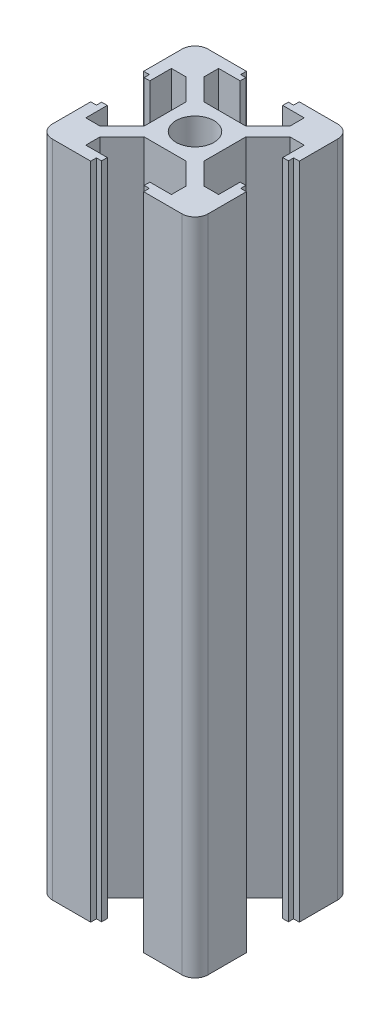
from build123d import *

# Parameters (mm, degrees)
SKETCH13_R                          = 3.65
BOSCHREXROTH_BOSCH_30X30_V2_1_DEPTH = 127


with BuildPart() as part:
    # Sketch13 → Boschrexroth BOSCH_30X30_V2(1) (new body)
    with BuildSketch(Plane.XZ.offset(-63.5)):
        with BuildLine():
            Line((0, 5.8), (-4.03, 5.8))
            Line((-4.03, 5.8), (-8.25, 10.02))
            Line((-8.25, 10.02), (-8.25, 12.8))
            Line((-8.25, 12.8), (-4.1, 12.8))
            Line((-4.1, 12.8), (-4.1, 13.9))
            Line((-4.1, 13.9), (-5.1, 13.9))
            Line((-5.1, 13.9), (-5.1, 15))
            Line((-5.1, 15), (-12.5, 15))
            ThreePointArc((-12.5, 15), (-14.267766953, 14.267766953), (-15, 12.5))
            Line((-15, 12.5), (-15, 5.1))
            Line((-15, 5.1), (-13.9, 5.1))
            Line((-13.9, 5.1), (-13.9, 4.1))
            Line((-13.9, 4.1), (-12.8, 4.1))
            Line((-12.8, 4.1), (-12.8, 8.25))
            Line((-12.8, 8.25), (-10.02, 8.25))
            Line((-10.02, 8.25), (-5.8, 4.03))
            Line((-5.8, 4.03), (-5.8, 0))
            Line((-5.8, 0), (-5.8, -4.03))
            Line((-5.8, -4.03), (-10.02, -8.25))
            Line((-10.02, -8.25), (-12.8, -8.25))
            Line((-12.8, -8.25), (-12.8, -4.1))
            Line((-12.8, -4.1), (-13.9, -4.1))
            Line((-13.9, -4.1), (-13.9, -5.1))
            Line((-13.9, -5.1), (-15, -5.1))
            Line((-15, -5.1), (-15, -12.5))
            ThreePointArc((-15, -12.5), (-14.267766953, -14.267766953), (-12.5, -15))
            Line((-12.5, -15), (-5.1, -15))
            Line((-5.1, -15), (-5.1, -13.9))
            Line((-5.1, -13.9), (-4.1, -13.9))
            Line((-4.1, -13.9), (-4.1, -12.8))
            Line((-4.1, -12.8), (-8.25, -12.8))
            Line((-8.25, -12.8), (-8.25, -10.02))
            Line((-8.25, -10.02), (-4.03, -5.8))
            Line((-4.03, -5.8), (4.03, -5.8))
            Line((4.03, -5.8), (8.25, -10.02))
            Line((8.25, -10.02), (8.25, -12.8))
            Line((8.25, -12.8), (4.1, -12.8))
            Line((4.1, -12.8), (4.1, -13.9))
            Line((4.1, -13.9), (5.1, -13.9))
            Line((5.1, -13.9), (5.1, -15))
            Line((5.1, -15), (12.5, -15))
            ThreePointArc((12.5, -15), (14.267766953, -14.267766953), (15, -12.5))
            Line((15, -12.5), (15, -5.1))
            Line((15, -5.1), (13.9, -5.1))
            Line((13.9, -5.1), (13.9, -4.1))
            Line((13.9, -4.1), (12.8, -4.1))
            Line((12.8, -4.1), (12.8, -8.25))
            Line((12.8, -8.25), (10.02, -8.25))
            Line((10.02, -8.25), (5.8, -4.03))
            Line((5.8, -4.03), (5.8, 0))
            Line((5.8, 0), (5.8, 4.03))
            Line((5.8, 4.03), (10.02, 8.25))
            Line((10.02, 8.25), (12.8, 8.25))
            Line((12.8, 8.25), (12.8, 4.1))
            Line((12.8, 4.1), (13.9, 4.1))
            Line((13.9, 4.1), (13.9, 5.1))
            Line((13.9, 5.1), (15, 5.1))
            Line((15, 5.1), (15, 12.5))
            ThreePointArc((15, 12.5), (14.267766953, 14.267766953), (12.5, 15))
            Line((12.5, 15), (5.1, 15))
            Line((5.1, 15), (5.1, 13.9))
            Line((5.1, 13.9), (4.1, 13.9))
            Line((4.1, 13.9), (4.1, 12.8))
            Line((4.1, 12.8), (8.25, 12.8))
            Line((8.25, 12.8), (8.25, 10.02))
            Line((8.25, 10.02), (4.03, 5.8))
            Line((4.03, 5.8), (0, 5.8))
        make_face()
        Circle(SKETCH13_R, mode=Mode.SUBTRACT)
    extrude(amount=BOSCHREXROTH_BOSCH_30X30_V2_1_DEPTH)


solid = part.part
